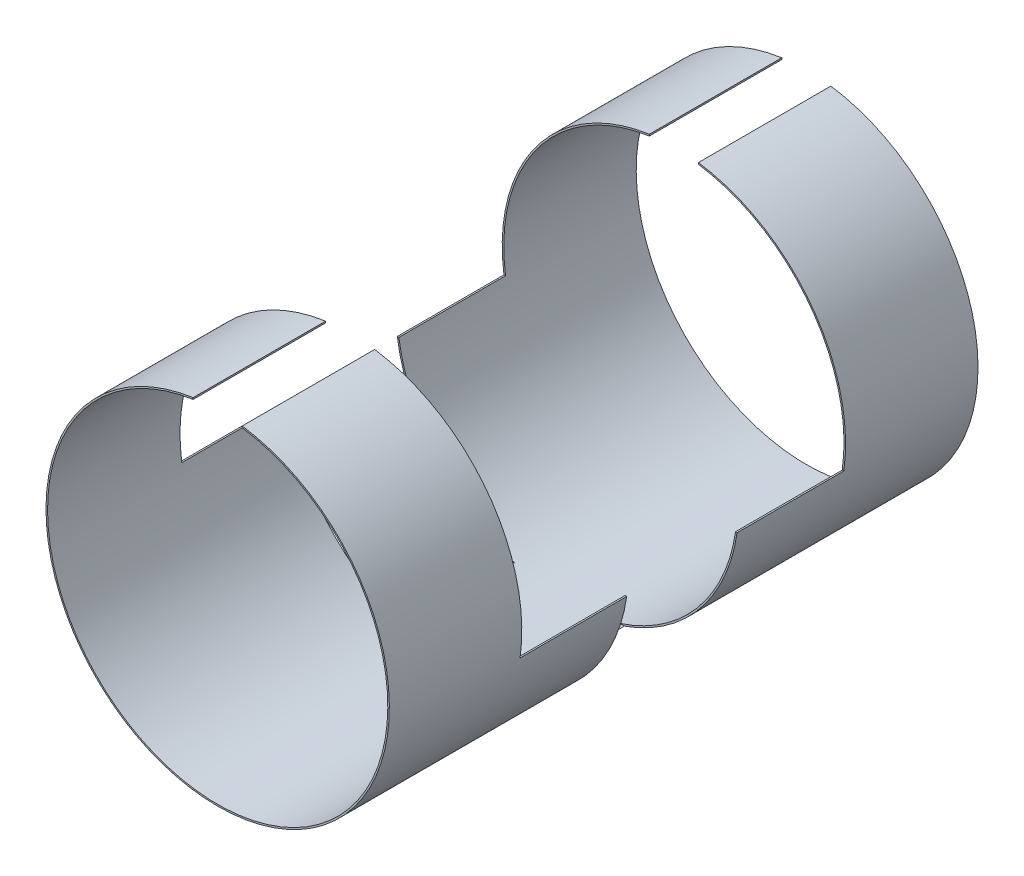
from build123d import *

# Parameters (mm, degrees)
SKETCH1_R               = 44.45
SKETCH1_R_2             = 44.0436
EXTRUDE1_DEPTH          = 152.4
CUT_EXTRUDE1_START      = -152.4
CUT_EXTRUDE1_DEPTH      = 152.4
CUT_EXTRUDE2_DEPTH      = 152.4
CUT_EXTRUDE2_DEPTH_BACK = 152.4
SKETCH3_W               = 83.82
SKETCH3_H               = 76.2
CUT_EXTRUDE3_DEPTH      = 152.4
CUT_EXTRUDE3_DEPTH_BACK = 152.4
SKETCH4_W               = 28.575
SKETCH4_H               = 35.56


with BuildPart() as part:
    # Sketch1 → Extrude1 (new body)
    with BuildSketch(Plane.XY):
        with Locations(Location((0, 0, 0), (0, 0, 180))):
            Circle(SKETCH1_R)
        with Locations(Location((0, 0, 0), (0, 0, 180))):
            Circle(SKETCH1_R_2, mode=Mode.SUBTRACT)
    extrude(amount=EXTRUDE1_DEPTH)

    # Sketch2 → Cut-Extrude1 (cut)
    with BuildSketch(Plane.XY.offset(152.4).offset(CUT_EXTRUDE1_START)):
        with BuildLine():
            Line((-6.35, 43.994090512), (-6.35, 43.583439526))
            ThreePointArc((-6.35, 43.583439526), (0, 44.0436), (6.35, 43.583439526))
            Line((6.35, 43.583439526), (6.35, 43.994090512))
            ThreePointArc((6.35, 43.994090512), (0, 44.45), (-6.35, 43.994090512))
        make_face()
    extrude(amount=CUT_EXTRUDE1_DEPTH, mode=Mode.SUBTRACT)

    # Sketch3 → Cut-Extrude2 (cut, two sides: drawn at the far end of the back side and taken through both)
    with BuildSketch(Plane(origin=(0, 0, 0), x_dir=(0, 0, -1), z_dir=(1, 0, 0)).offset(-CUT_EXTRUDE2_DEPTH_BACK)):
        with Locations((-76.2, 31.75)):
            Rectangle(SKETCH3_W, SKETCH3_H)
    extrude(amount=CUT_EXTRUDE2_DEPTH + CUT_EXTRUDE2_DEPTH_BACK, mode=Mode.SUBTRACT)

    # Sketch4 → Cut-Extrude3 (cut, two sides: drawn at the far end of the back side and taken through both)
    with BuildSketch(Plane(origin=(0, 0, 0), x_dir=(0, 0, -1), z_dir=(1, 0, 0)).offset(-CUT_EXTRUDE3_DEPTH_BACK)):
        with Locations((-76.2, -24.13)):
            Rectangle(SKETCH4_W, SKETCH4_H)
    extrude(amount=CUT_EXTRUDE3_DEPTH + CUT_EXTRUDE3_DEPTH_BACK, mode=Mode.SUBTRACT)


solid = part.part
